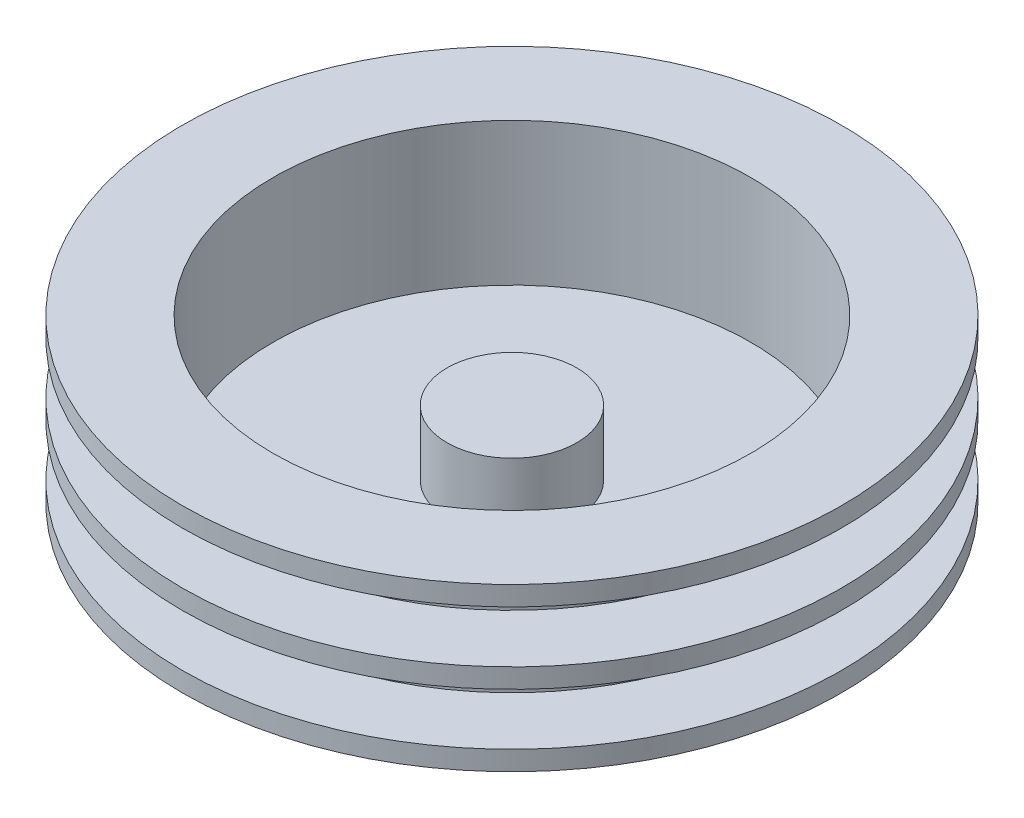
from build123d import *

# Parameters (mm, degrees)
SKETCH1_R           = 25.4
BOSS_EXTRUDE1_DEPTH = 1.5
BOSS_EXTRUDE2_START = 1.5
SKETCH1_3_R         = 20.066
SKETCH1_3_R_2       = 18.415
BOSS_EXTRUDE2_DEPTH = 4
BOSS_EXTRUDE3_START = 5.5
SKETCH1_4_R         = 25.4
SKETCH1_4_R_2       = 20.066
SKETCH1_4_R_3       = 18.415
BOSS_EXTRUDE3_DEPTH = 1.5
BOSS_EXTRUDE4_START = 7
SKETCH1_5_R         = 20.066
SKETCH1_5_R_2       = 18.415
BOSS_EXTRUDE4_DEPTH = 4
BOSS_EXTRUDE5_START = 11
SKETCH1_6_R         = 25.4
SKETCH1_6_R_2       = 20.066
SKETCH1_6_R_3       = 18.415
BOSS_EXTRUDE5_DEPTH = 1.5
BOSS_EXTRUDE6_START = 1.5
SKETCH1_7_R         = 5
BOSS_EXTRUDE6_DEPTH = 5


with BuildPart() as part:
    # Sketch1 → Boss-Extrude1 (new body)
    with BuildSketch(Plane(origin=(0, 0, 0), x_dir=(1, 0, 0), z_dir=(0, 1, 0))):
        with Locations(Location((0, 0, 0), (0, 0, 270))):
            Circle(SKETCH1_R)
    extrude(amount=BOSS_EXTRUDE1_DEPTH)

    # Sketch1<3> → Boss-Extrude2 (add)
    with BuildSketch(Plane(origin=(0, 0, 0), x_dir=(1, 0, 0), z_dir=(0, 1, 0)).offset(BOSS_EXTRUDE2_START)):
        with Locations(Location((0, 0, 0), (0, 0, 270))):
            Circle(SKETCH1_3_R)
        with Locations(Location((0, 0, 0), (0, 0, 270))):
            Circle(SKETCH1_3_R_2, mode=Mode.SUBTRACT)
    extrude(amount=BOSS_EXTRUDE2_DEPTH)

    # Sketch1<4> → Boss-Extrude3 (add)
    # profile 1 of 2: a face of its own
    with BuildSketch(Plane(origin=(0, 0, 0), x_dir=(1, 0, 0), z_dir=(0, 1, 0)).offset(BOSS_EXTRUDE3_START)):
        with Locations(Location((0, 0, 0), (0, 0, 270))):
            Circle(SKETCH1_4_R)
        with Locations(Location((0, 0, 0), (0, 0, 270))):
            Circle(SKETCH1_4_R_2, mode=Mode.SUBTRACT)
    # profile 2 of 2: a face of its own
    with BuildSketch(Plane(origin=(0, 0, 0), x_dir=(1, 0, 0), z_dir=(0, 1, 0)).offset(BOSS_EXTRUDE3_START)):
        with Locations(Location((0, 0, 0), (0, 0, 270))):
            Circle(SKETCH1_4_R_2)
        with Locations(Location((0, 0, 0), (0, 0, 270))):
            Circle(SKETCH1_4_R_3, mode=Mode.SUBTRACT)
    extrude(amount=BOSS_EXTRUDE3_DEPTH)

    # Sketch1<5> → Boss-Extrude4 (add)
    with BuildSketch(Plane(origin=(0, 0, 0), x_dir=(1, 0, 0), z_dir=(0, 1, 0)).offset(BOSS_EXTRUDE4_START)):
        with Locations(Location((0, 0, 0), (0, 0, 270))):
            Circle(SKETCH1_5_R)
        with Locations(Location((0, 0, 0), (0, 0, 270))):
            Circle(SKETCH1_5_R_2, mode=Mode.SUBTRACT)
    extrude(amount=BOSS_EXTRUDE4_DEPTH)

    # Sketch1<6> → Boss-Extrude5 (add)
    # profile 1 of 2: a face of its own
    with BuildSketch(Plane(origin=(0, 0, 0), x_dir=(1, 0, 0), z_dir=(0, 1, 0)).offset(BOSS_EXTRUDE5_START)):
        with Locations(Location((0, 0, 0), (0, 0, 270))):
            Circle(SKETCH1_6_R)
        with Locations(Location((0, 0, 0), (0, 0, 270))):
            Circle(SKETCH1_6_R_2, mode=Mode.SUBTRACT)
    # profile 2 of 2: a face of its own
    with BuildSketch(Plane(origin=(0, 0, 0), x_dir=(1, 0, 0), z_dir=(0, 1, 0)).offset(BOSS_EXTRUDE5_START)):
        with Locations(Location((0, 0, 0), (0, 0, 270))):
            Circle(SKETCH1_6_R_2)
        with Locations(Location((0, 0, 0), (0, 0, 270))):
            Circle(SKETCH1_6_R_3, mode=Mode.SUBTRACT)
    extrude(amount=BOSS_EXTRUDE5_DEPTH)

    # Sketch1<7> → Boss-Extrude6 (add)
    with BuildSketch(Plane(origin=(0, 0, 0), x_dir=(1, 0, 0), z_dir=(0, 1, 0)).offset(BOSS_EXTRUDE6_START)):
        with Locations(Location((0, 0, 0), (0, 0, 270))):
            Circle(SKETCH1_7_R)
    extrude(amount=BOSS_EXTRUDE6_DEPTH)


solid = part.part
